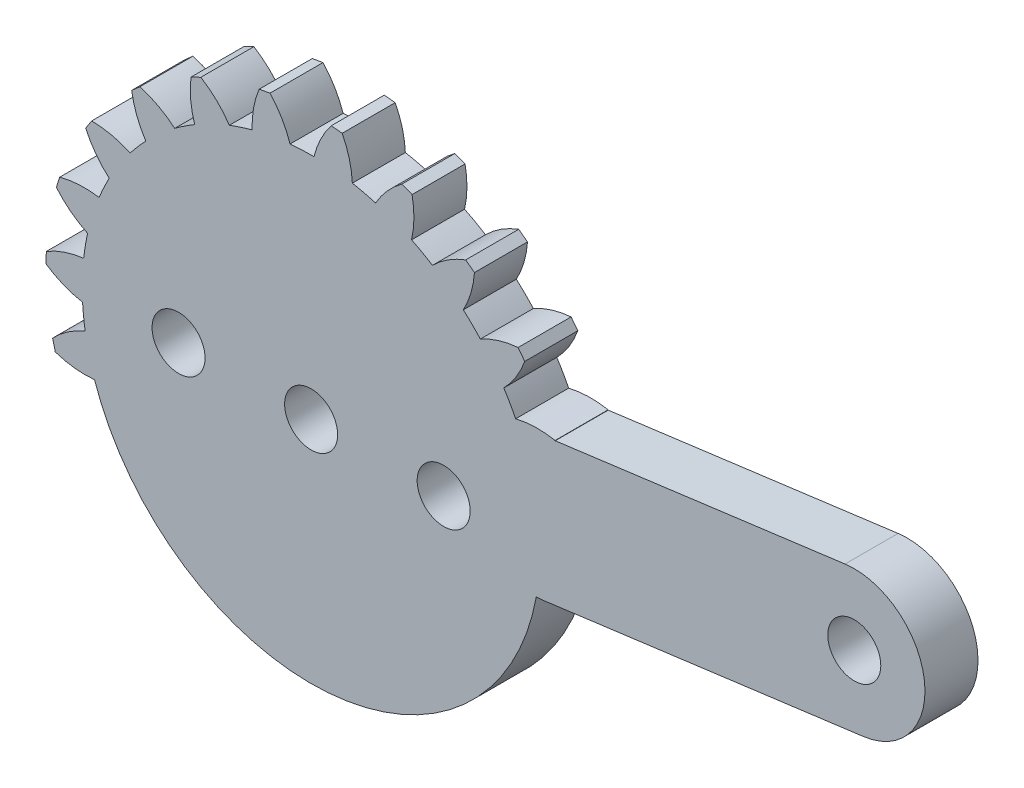
from build123d import *

# Parameters (mm, degrees)
SKETCH1_R           = 1.5
BOSS_EXTRUDE1_DEPTH = 3


with BuildPart() as part:
    # Sketch1 → Boss-Extrude1 (new body)
    with BuildSketch(Plane.XY):
        with BuildLine():
            Line((31.252104769, 0.084220555), (13.197893843, -2.292661406))
            ThreePointArc((13.197893843, -2.292661406), (12.969095602, -2.316113876), (12.73932764, -2.326377285))
            ThreePointArc((12.73932764, -2.326377285), (0.959824701, -12.914380997), (-12.255459075, -4.184043841))
            ThreePointArc((-12.255459075, -4.184043841), (-13.378578492, -4.178547185), (-14.474839872, -3.934337388))
            Line((-14.474839872, -3.934337388), (-14.625059689, -3.332810991))
            ThreePointArc((-14.625059689, -3.332810991), (-13.772322314, -2.601875695), (-12.783651334, -2.068999412))
            ThreePointArc((-12.783651334, -2.068999412), (-12.874361077, -1.397614704), (-12.929834926, -0.722404858))
            ThreePointArc((-12.929834926, -0.722404858), (-14.009823049, -0.414098041), (-14.999545068, 0.116823575))
            Line((-14.999545068, 0.116823575), (-14.981904447, 0.736572564))
            ThreePointArc((-14.981904447, 0.736572564), (-13.963584904, 1.210337006), (-12.867808226, 1.456712552))
            ThreePointArc((-12.867808226, 1.456712552), (-12.774016779, 2.12767369), (-12.645264071, 2.792811588))
            ThreePointArc((-12.645264071, 2.792811588), (-13.60202312, 3.381062861), (-14.411802625, 4.159320268))
            Line((-14.411802625, 4.159320268), (-14.22760989, 4.7513279))
            ThreePointArc((-14.22760989, 4.7513279), (-13.119232281, 4.932784547), (-11.997618648, 4.87438681))
            ThreePointArc((-11.997618648, 4.87438681), (-11.726282094, 5.495162259), (-11.422851828, 6.100897975))
            ThreePointArc((-11.422851828, 6.100897975), (-12.185423363, 6.925465798), (-12.755202711, 7.893339205))
            Line((-12.755202711, 7.893339205), (-12.418118595, 8.413698983))
            ThreePointArc((-12.418118595, 8.413698983), (-11.301886217, 8.289390025), (-10.23762058, 7.930550098))
            ThreePointArc((-10.23762058, 7.930550098), (-9.80886271, 8.455099783), (-9.353258921, 8.95650867))
            ThreePointArc((-9.353258921, 8.95650867), (-9.865086498, 9.956238618), (-10.152607763, 11.041945282))
            Line((-10.152607763, 11.041945282), (-9.687632252, 11.452064502))
            ThreePointArc((-9.687632252, 11.452064502), (-8.646330954, 11.031209366), (-7.718345028, 10.398540764))
            ThreePointArc((-7.718345028, 10.398540764), (-7.163964851, 10.787961235), (-6.589977589, 11.147856089))
            ThreePointArc((-6.589977589, 11.147856089), (-6.813101299, 12.248602767), (-6.797040342, 13.371620791))
            Line((-6.797040342, 13.371620791), (-6.238658543, 13.641082786))
            ThreePointArc((-6.238658543, 13.641082786), (-5.349516879, 12.954894372), (-4.626635134, 12.095319232))
            ThreePointArc((-4.626635134, 12.095319232), (-3.987748493, 12.320728954), (-3.337947765, 12.51241802))
            ThreePointArc((-3.337947765, 12.51241802), (-3.255819543, 13.632544082), (-2.937367534, 14.709584358))
            Line((-2.937367534, 14.709584358), (-2.32699207, 14.818404364))
            ThreePointArc((-2.32699207, 14.818404364), (-1.65595361, 13.917774128), (-1.191788878, 12.895043205))
            ThreePointArc((-1.191788878, 12.895043205), (-0.515779071, 12.93972457), (0.161642374, 12.948991148))
            ThreePointArc((0.161642374, 12.948991148), (0.542931453, 14.005421967), (1.140156387, 14.956605344))
            Line((1.140156387, 14.956605344), (1.757256759, 14.89671268))
            ThreePointArc((1.757256759, 14.89671268), (2.160424164, 13.848436246), (2.331446907, 12.738400815))
            ThreePointArc((2.331446907, 12.738400815), (2.994443325, 12.59904001), (3.649244238, 12.425196839))
            ThreePointArc((3.649244238, 12.425196839), (4.301415708, 13.339581776), (5.133120125, 14.094363334))
            Line((5.133120125, 14.094363334), (5.711177894, 13.870199965))
            ThreePointArc((5.711177894, 13.870199965), (5.81657316, 12.752023201), (5.681769941, 11.63700951))
            ThreePointArc((5.681769941, 11.63700951), (6.282581558, 11.323942289), (6.86619835, 10.979882523))
            ThreePointArc((6.86619835, 10.979882523), (7.740883637, 11.684405828), (8.745383825, 12.186806873))
            Line((8.745383825, 12.186806873), (9.241527091, 11.81499797))
            ThreePointArc((9.241527091, 11.81499797), (9.041333534, 10.709850931), (8.610702091, 9.672554446))
            ThreePointArc((8.610702091, 9.672554446), (9.104769458, 9.208999572), (9.573917942, 8.720240549))
            ThreePointArc((9.573917942, 8.720240549), (10.606245638, 9.162650954), (11.709042415, 9.375410697))
            Line((11.709042415, 9.375410697), (12.086474501, 8.883531626))
            ThreePointArc((12.086474501, 8.883531626), (11.595539562, 7.873378012), (10.901017858, 6.990730267))
            ThreePointArc((10.901017858, 6.990730267), (11.251698258, 6.411067486), (11.571583838, 5.813858226))
            ThreePointArc((11.571583838, 5.813858226), (12.684990922, 5.961344174), (13.804294894, 5.868683199))
            Line((13.804294894, 5.868683199), (13.809047255, 5.856830152))
            Line((13.809047255, 5.856830152), (30.207895231, 8.015779445))
            ThreePointArc((30.207895231, 8.015779445), (34.695779445, 4.572104769), (31.252104769, 0.084220555))
        make_face()
        Circle(SKETCH1_R, mode=Mode.SUBTRACT)
        with Locations((7.5, 0)):
            Circle(SKETCH1_R, mode=Mode.SUBTRACT)
        with Locations((-7.5, 0)):
            Circle(SKETCH1_R, mode=Mode.SUBTRACT)
        with Locations((30.73, 4.05)):
            Circle(SKETCH1_R, mode=Mode.SUBTRACT)
    extrude(amount=BOSS_EXTRUDE1_DEPTH)


solid = part.part
